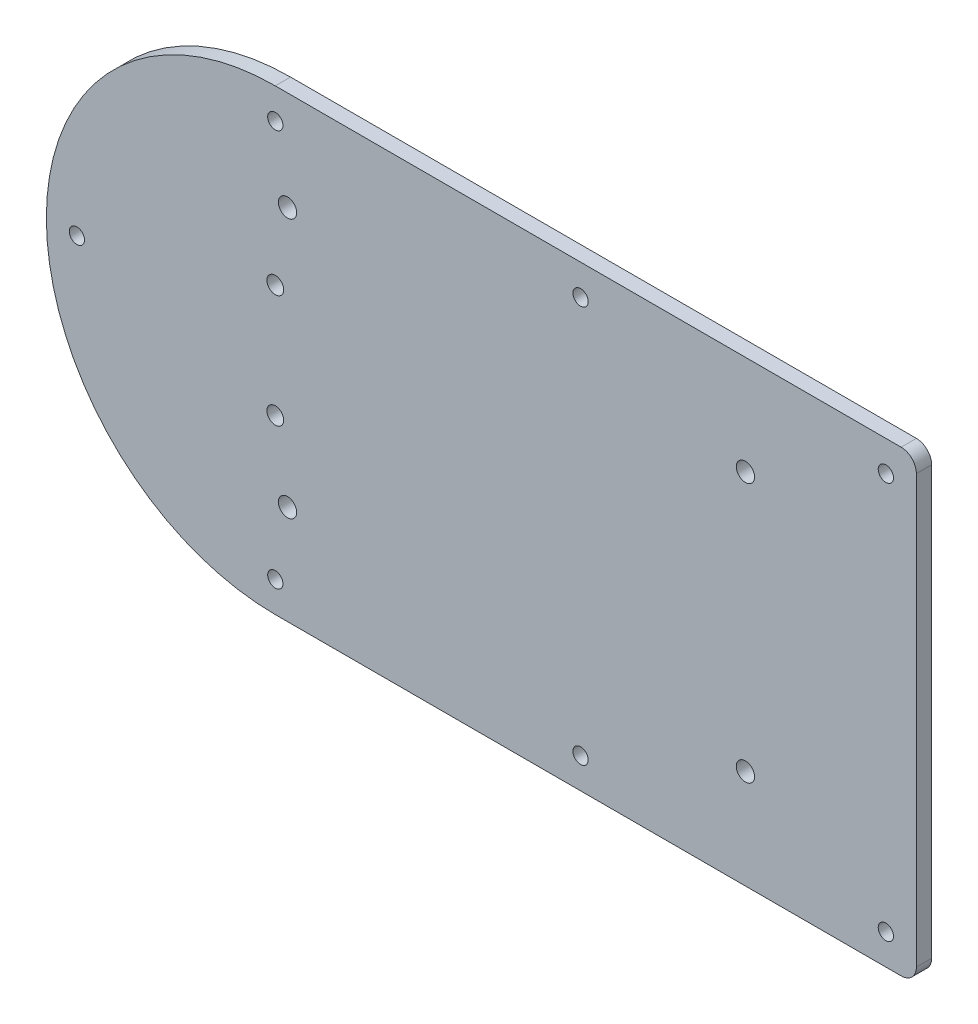
from build123d import *

# Parameters (mm, degrees)
SKETCH1_R           = 3
SKETCH1_R_2         = 2.5
SKETCH1_R_3         = 2.75
BOSS_EXTRUDE1_DEPTH = 5


with BuildPart() as part:
    # Sketch1 → Boss-Extrude1 (new body)
    with BuildSketch(Plane.XY):
        with BuildLine():
            Line((30.000692042, 92.545526446), (235.000692042, 92.545526446))
            ThreePointArc((235.000692042, 92.545526446), (238.536225947, 91.081060352), (240.000692042, 87.545526446))
            Line((240.000692042, 87.545526446), (240.000692042, -52.454473554))
            ThreePointArc((240.000692042, -52.454473554), (238.536225947, -55.99000746), (235.000692042, -57.454473554))
            Line((235.000692042, -57.454473554), (30.000692042, -57.454473554))
            ThreePointArc((30.000692042, -57.454473554), (-44.999307958, 17.545526446), (30.000692042, 92.545526446))
        make_face()
        with Locations((184.000692042, 60.045526446)):
            Circle(SKETCH1_R, mode=Mode.SUBTRACT)
        with Locations((184.000692042, -24.954473554)):
            Circle(SKETCH1_R, mode=Mode.SUBTRACT)
        with Locations((34.000692042, 60.045526446)):
            Circle(SKETCH1_R, mode=Mode.SUBTRACT)
        with Locations((34.000692042, -24.954473554)):
            Circle(SKETCH1_R, mode=Mode.SUBTRACT)
        with Locations((-34.999307958, 17.545526446)):
            Circle(SKETCH1_R_2, mode=Mode.SUBTRACT)
        with Locations((30.000692042, 36.045526446)):
            Circle(SKETCH1_R_3, mode=Mode.SUBTRACT)
        with Locations((30.000692042, -0.954473554)):
            Circle(SKETCH1_R_3, mode=Mode.SUBTRACT)
        with Locations((30.000692042, -47.454473554)):
            Circle(SKETCH1_R_2, mode=Mode.SUBTRACT)
        with Locations((30.000692042, 82.545526446)):
            Circle(SKETCH1_R_2, mode=Mode.SUBTRACT)
        with Locations((230.000692042, -47.454473554)):
            Circle(SKETCH1_R_2, mode=Mode.SUBTRACT)
        with Locations((230.000692042, 82.545526446)):
            Circle(SKETCH1_R_2, mode=Mode.SUBTRACT)
        with Locations((130.000692042, 82.545526446)):
            Circle(SKETCH1_R_2, mode=Mode.SUBTRACT)
        with Locations((130.000692042, -47.454473554)):
            Circle(SKETCH1_R_2, mode=Mode.SUBTRACT)
    extrude(amount=BOSS_EXTRUDE1_DEPTH)


solid = part.part
